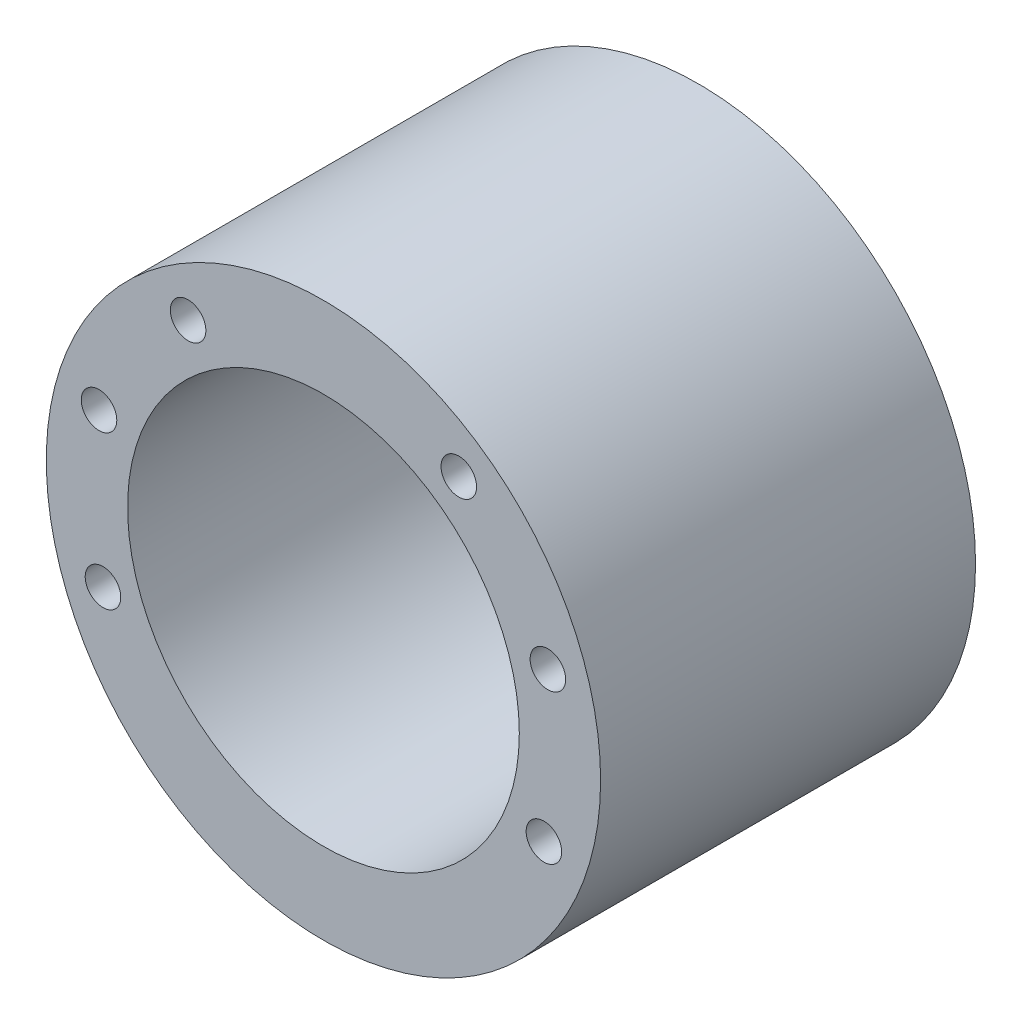
from build123d import *

# Parameters (mm, degrees)
SKETCH1_R           = 49.53
SKETCH1_R_2         = 3.175
SKETCH1_R_3         = 35
BOSS_EXTRUDE1_DEPTH = 67


with BuildPart() as part:
    # Sketch1 → Boss-Extrude1 (new body)
    with BuildSketch(Plane.XY):
        Circle(SKETCH1_R)
        with Locations((-39.397117561, -14.555656215)):
            Circle(SKETCH1_R_2, mode=Mode.SUBTRACT)
        Circle(SKETCH1_R_3, mode=Mode.SUBTRACT)
        with Locations((39.397117561, -14.555656215)):
            Circle(SKETCH1_R_2, mode=Mode.SUBTRACT)
        with Locations((-40.104626484, 12.474731845)):
            Circle(SKETCH1_R_2, mode=Mode.SUBTRACT)
        with Locations((-24.189576015, 34.334594977)):
            Circle(SKETCH1_R_2, mode=Mode.SUBTRACT)
        with Locations((40.104626484, 12.474731845)):
            Circle(SKETCH1_R_2, mode=Mode.SUBTRACT)
        with Locations((24.189576015, 34.334594977)):
            Circle(SKETCH1_R_2, mode=Mode.SUBTRACT)
    extrude(amount=-BOSS_EXTRUDE1_DEPTH)


solid = part.part
